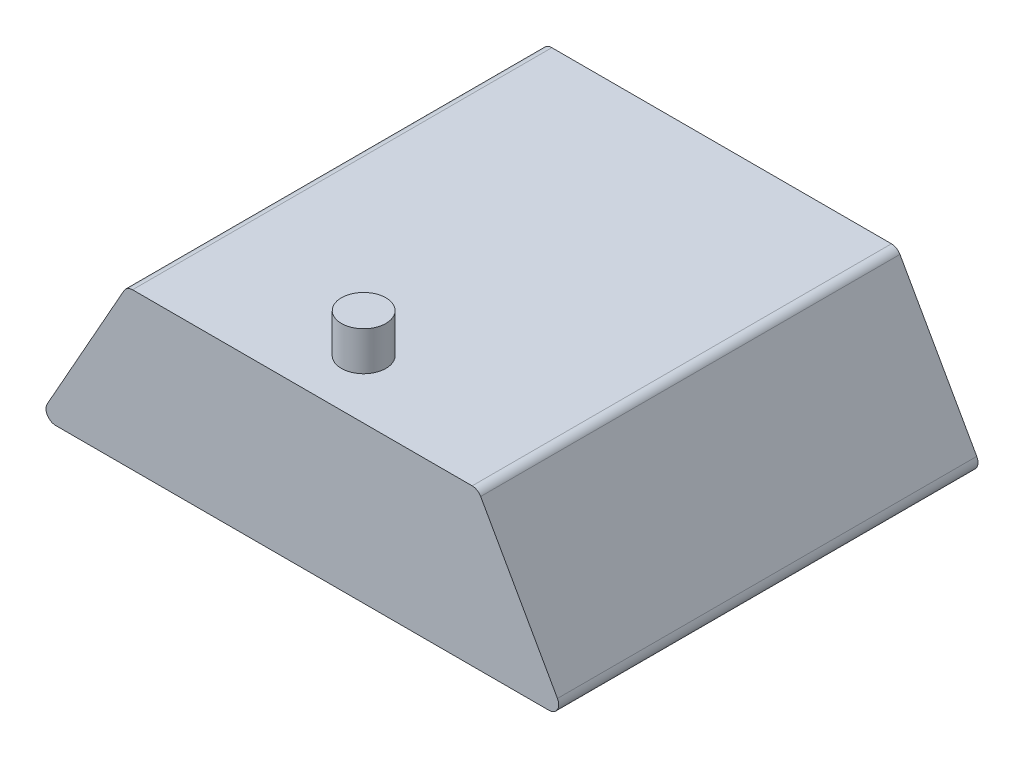
from build123d import *

# Parameters (mm, degrees)
EXTRUDE_1_DEPTH           = 215
SKETCH_2_R                = 12.5
EXTRUDE_2_DEPTH           = 10
EXTRUDE_2_DRAFT           = 15
EXTRUDE_2_PROFILE_2_DEPTH = 10
EXTRUDE_2_PROFILE_2_DRAFT = 15
EXTRUDE_2_PROFILE_3_DEPTH = 10
EXTRUDE_2_PROFILE_3_DRAFT = 15
EXTRUDE_2_PROFILE_4_DEPTH = 10
EXTRUDE_2_PROFILE_4_DRAFT = 15
SKETCH1_R                 = 11.40437452
BOSS_EXTRUDE1_DEPTH       = 20


with BuildPart() as part:
    # 草圖1 → 填料-伸長1 (new body)
    with BuildSketch(Plane.XY):
        with BuildLine():
            Line((-130.808640264, -66.769197125), (-91.433640264, 3.230802875))
            ThreePointArc((-91.433640264, 3.230802875), (-89.599992065, 5.095544116), (-87.075762578, 5.779496677))
            Line((-87.075762578, 5.779496677), (87.075762578, 5.779496677))
            ThreePointArc((87.075762578, 5.779496677), (89.599992065, 5.095544116), (91.433640264, 3.230802875))
            Line((91.433640264, 3.230802875), (130.808640264, -66.769197125))
            ThreePointArc((130.808640264, -66.769197125), (130.766810017, -71.74473281), (126.450762578, -74.220503323))
            Line((126.450762578, -74.220503323), (-126.450762578, -74.220503323))
            ThreePointArc((-126.450762578, -74.220503323), (-130.766810017, -71.74473281), (-130.808640264, -66.769197125))
        make_face()
    extrude(amount=EXTRUDE_1_DEPTH)


with BuildPart() as extrude_2_tool:
    # 草圖2 → 填料-伸長2 (with draft: the straight prism first)
    with BuildSketch(Plane.XZ.offset(74.220503323)):
        with Locations((-100, 185.989670211)):
            Circle(SKETCH_2_R)
    extrude(amount=EXTRUDE_2_DEPTH)
    # 填料-伸長2: the draft: its side faces are tilted about the plane it starts from
    extrude_2_sides = [extrude_2_tool.faces().sort_by_distance(p)[0] for p in [
        (-112.5, -79.220503323, 185.989670211),
    ]]
    draft(extrude_2_sides, Plane.XZ.offset(74.220503323), EXTRUDE_2_DRAFT)


with BuildPart() as part_1:
    add(part.part)

    # 填料-伸長2: add extrude_2_tool
    add(extrude_2_tool.part)


with BuildPart() as extrude_2_profile_2_tool:
    # 草圖2 → 填料-伸長2 profile 2 (with draft: the straight prism first)
    with BuildSketch(Plane.XZ.offset(74.220503323)):
        with Locations((-100, 29.010329789)):
            Circle(SKETCH_2_R)
    extrude(amount=EXTRUDE_2_PROFILE_2_DEPTH)
    # 填料-伸長2 profile 2: the draft: its side faces are tilted about the plane it starts from
    extrude_2_profile_2_sides = [extrude_2_profile_2_tool.faces().sort_by_distance(p)[0] for p in [
        (-112.5, -79.220503323, 29.010329789),
    ]]
    draft(extrude_2_profile_2_sides, Plane.XZ.offset(74.220503323), EXTRUDE_2_PROFILE_2_DRAFT)


with BuildPart() as part_2:
    add(part_1.part)

    # 填料-伸長2 profile 2: add extrude_2_profile_2_tool
    add(extrude_2_profile_2_tool.part)


with BuildPart() as extrude_2_profile_3_tool:
    # 草圖2 → 填料-伸長2 profile 3 (with draft: the straight prism first)
    with BuildSketch(Plane.XZ.offset(74.220503323)):
        with Locations((100, 29.010329789)):
            Circle(SKETCH_2_R)
    extrude(amount=EXTRUDE_2_PROFILE_3_DEPTH)
    # 填料-伸長2 profile 3: the draft: its side faces are tilted about the plane it starts from
    extrude_2_profile_3_sides = [extrude_2_profile_3_tool.faces().sort_by_distance(p)[0] for p in [
        (87.5, -79.220503323, 29.010329789),
    ]]
    draft(extrude_2_profile_3_sides, Plane.XZ.offset(74.220503323), EXTRUDE_2_PROFILE_3_DRAFT)


with BuildPart() as part_3:
    add(part_2.part)

    # 填料-伸長2 profile 3: add extrude_2_profile_3_tool
    add(extrude_2_profile_3_tool.part)


with BuildPart() as extrude_2_profile_4_tool:
    # 草圖2 → 填料-伸長2 profile 4 (with draft: the straight prism first)
    with BuildSketch(Plane.XZ.offset(74.220503323)):
        with Locations((100, 185.989670211)):
            Circle(SKETCH_2_R)
    extrude(amount=EXTRUDE_2_PROFILE_4_DEPTH)
    # 填料-伸長2 profile 4: the draft: its side faces are tilted about the plane it starts from
    extrude_2_profile_4_sides = [extrude_2_profile_4_tool.faces().sort_by_distance(p)[0] for p in [
        (87.5, -79.220503323, 185.989670211),
    ]]
    draft(extrude_2_profile_4_sides, Plane.XZ.offset(74.220503323), EXTRUDE_2_PROFILE_4_DRAFT)


with BuildPart() as part_4:
    add(part_3.part)

    # 填料-伸長2 profile 4: add extrude_2_profile_4_tool
    add(extrude_2_profile_4_tool.part)

    # Sketch1 → Boss-Extrude1 (add)
    with BuildSketch(Plane(origin=(0, 5.779496677, 0), x_dir=(1, 0, 0), z_dir=(0, 1, 0))):
        with Locations(Location((1.433640264, -185, 0), (0, 0, 270))):
            Circle(SKETCH1_R)
    extrude(amount=BOSS_EXTRUDE1_DEPTH)


solid = part_4.part
